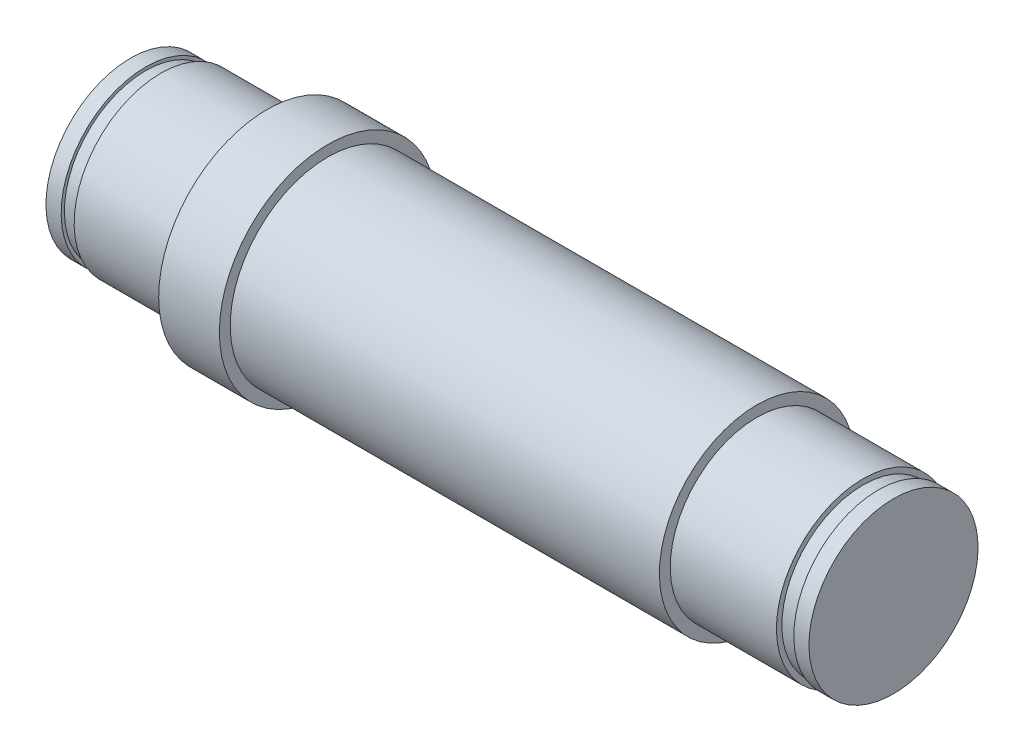
from build123d import *

# Parameters (mm, degrees)
SKETCH4_W = 2.8
SKETCH4_H = 0.5


with BuildPart() as part:
    # Sketch2 → Revolve1 (revolve)
    with BuildSketch(Plane.XY):
        Polygon((17.6, 0), (-17.6, 0), (-17.6, 3.9), (-16.9, 3.9), (-16.9, 3.75), (-16.2, 3.75), (-16.2, 4), (-11.3, 4), (-11.3, 4.5), (11.3, 4.5), (11.3, 4), (16.2, 4), (16.2, 3.75), (16.9, 3.75), (16.9, 3.9), (17.6, 3.9), align=None)
    revolve(axis=Axis((23.008886434, 0, 0), (-1, 0, 0)))

    # Sketch4 → Revolve2 (revolve)
    with BuildSketch(Plane.XY):
        with Locations((-9.9, 4.75)):
            Rectangle(SKETCH4_W, SKETCH4_H)
    revolve(axis=Axis((0, 0, 0), (-1, 0, 0)))


solid = part.part
